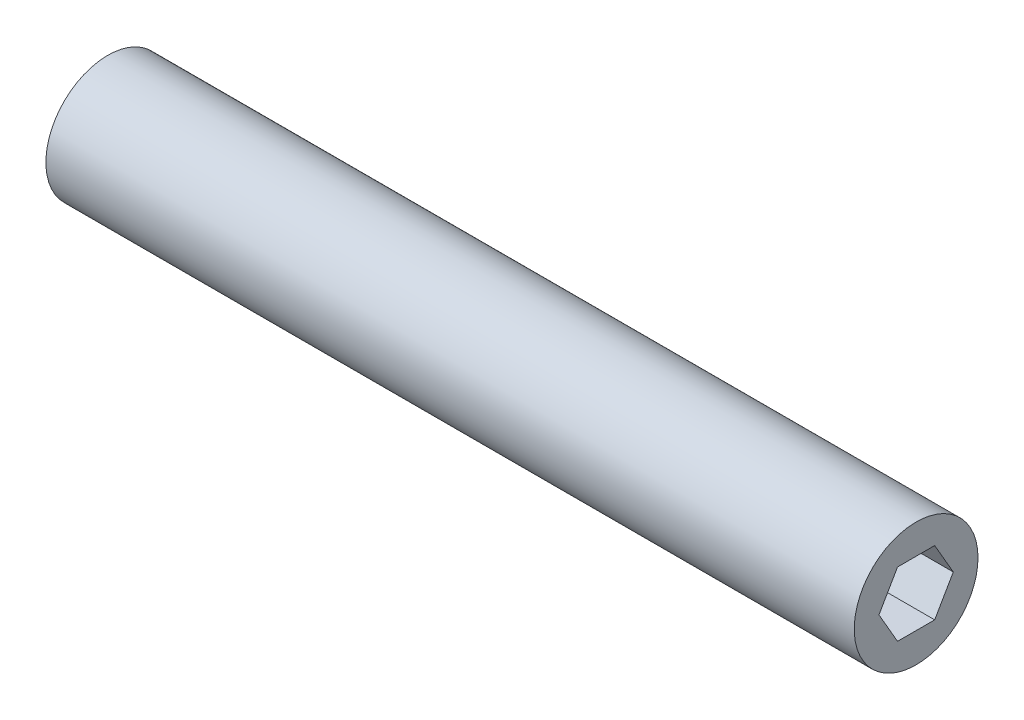
from build123d import *

# Parameters (mm, degrees)
SKETCH1_R           = 12.7
BOSS_EXTRUDE1_DEPTH = 165.89375


with BuildPart() as part:
    # Sketch1 → Boss-Extrude1 (new body)
    with BuildSketch(Plane(origin=(0, 0, 0), x_dir=(0, 0, -1), z_dir=(1, 0, 0))):
        Circle(SKETCH1_R)
        Polygon((7.625642355, 0), (3.812821178, 6.604), (-3.812821178, 6.604), (-7.625642355, 0), (-3.812821178, -6.604), (3.812821178, -6.604), align=None, mode=Mode.SUBTRACT)
    extrude(amount=BOSS_EXTRUDE1_DEPTH)


solid = part.part
